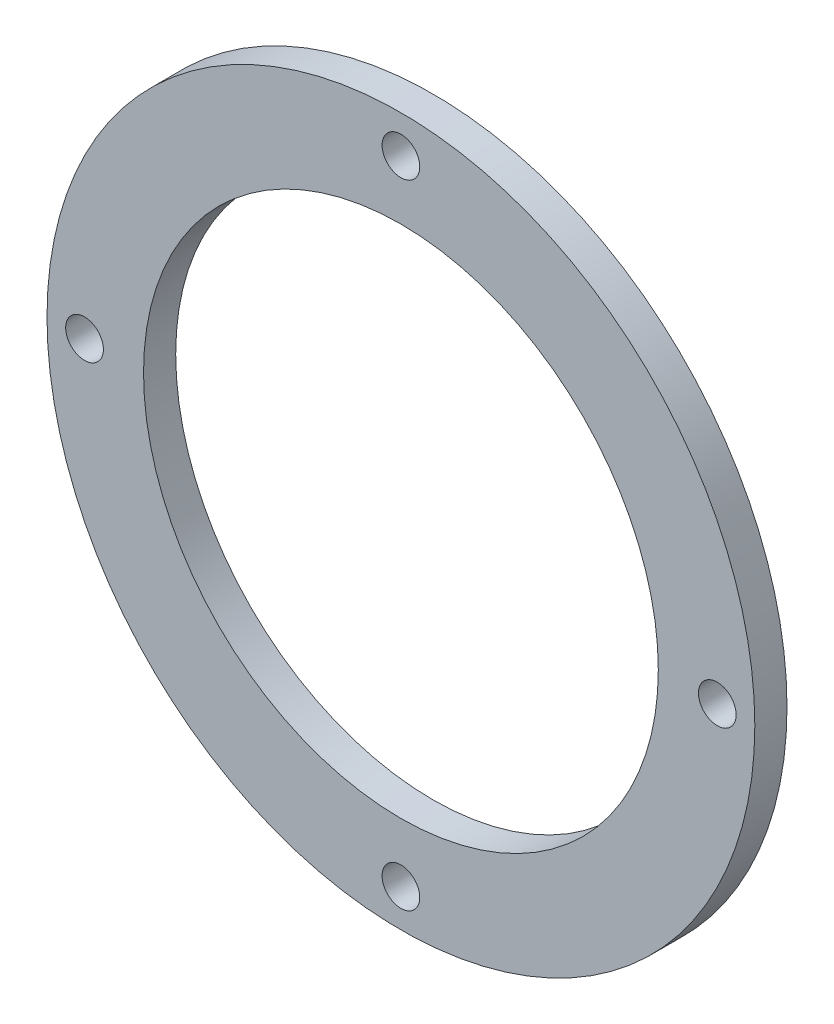
from build123d import *

# Parameters (mm, degrees)
SKETCH1_R           = 33
SKETCH1_R_2         = 24
SKETCH1_R_3         = 1.757235194
BOSS_EXTRUDE1_DEPTH = 3


with BuildPart() as part:
    # Sketch1 → Boss-Extrude1 (new body)
    with BuildSketch(Plane.XY):
        Circle(SKETCH1_R)
        Circle(SKETCH1_R_2, mode=Mode.SUBTRACT)
        with Locations((0, 29.5)):
            Circle(SKETCH1_R_3, mode=Mode.SUBTRACT)
        with Locations((29.5, 0)):
            Circle(SKETCH1_R_3, mode=Mode.SUBTRACT)
        with Locations((0, -29.5)):
            Circle(SKETCH1_R_3, mode=Mode.SUBTRACT)
        with Locations((-29.5, 0)):
            Circle(SKETCH1_R_3, mode=Mode.SUBTRACT)
    extrude(amount=BOSS_EXTRUDE1_DEPTH)


solid = part.part
